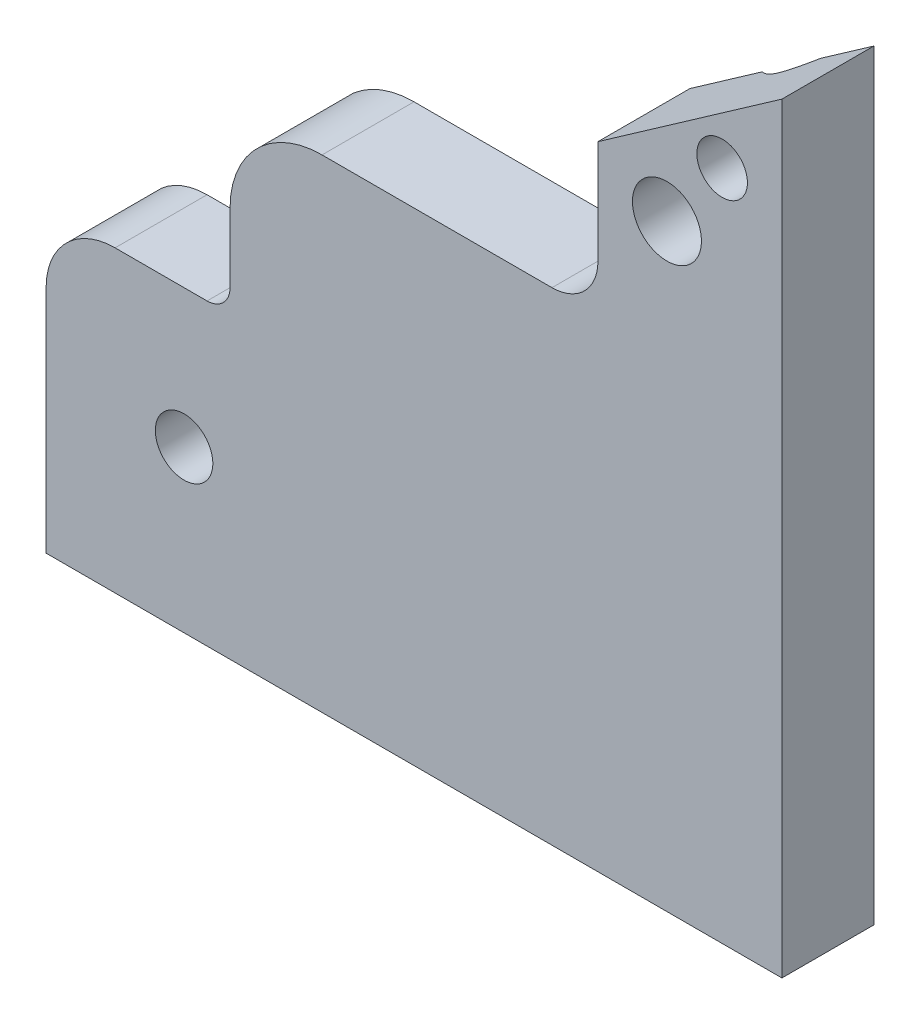
from build123d import *

# Parameters (mm, degrees)
SKETCH1_W                     = 32
SKETCH1_H                     = 27.5
BOSS_EXTRUDE1_DEPTH           = 4
SKETCH2_W                     = 8
SKETCH2_H                     = 14.5
CUT_EXTRUDE1_DEPTH            = 42.112650121
SKETCH3_W                     = 16
SKETCH3_H                     = 6.5
CUT_EXTRUDE2_DEPTH            = 42.112650121
DRAFT1_ANGLE                  = 35.000000002
F_3_0_3_DIAMETER_HOLE1_D      = 3
CSK_FOR_M3_SFHCS1_D           = 2.2
CSK_FOR_M3_SFHCS1_DEPTH       = 9.5
CSK_FOR_M3_SFHCS1_CSINK_D     = 4.6
CSK_FOR_M3_SFHCS1_CSINK_ANGLE = 90
CSK_FOR_M3_SFHCS1_TIP         = 0.660946681
M3X0_5_TAPPED_HOLE2_D         = 2.5
M3X0_5_TAPPED_HOLE2_DEPTH     = 7.5
M3X0_5_TAPPED_HOLE2_TIP       = 0.751075774
FILLET1_R                     = 1
FILLET2_R                     = 2
FILLET3_R                     = 3
FILLET4_R                     = 4
M3X0_5_TAPPED_HOLE1_D         = 2.5


with BuildPart() as part:
    # Sketch1 → Boss-Extrude1 (new body)
    with BuildSketch(Plane.XY.offset(4)):
        with Locations((16, 11.75)):
            Rectangle(SKETCH1_W, SKETCH1_H)
    extrude(amount=-BOSS_EXTRUDE1_DEPTH)

    # Sketch2 → Cut-Extrude1 (cut, through all)
    with BuildSketch(Plane(origin=(0, 0, 0), x_dir=(-1, 0, 0), z_dir=(0, 0, -1))):
        with Locations((-4, 18.25)):
            Rectangle(SKETCH2_W, SKETCH2_H)
    extrude(amount=-CUT_EXTRUDE1_DEPTH, mode=Mode.SUBTRACT)

    # Sketch3 → Cut-Extrude2 (cut, through all)
    with BuildSketch(Plane(origin=(0, 0, 0), x_dir=(-1, 0, 0), z_dir=(0, 0, -1))):
        with Locations((-16, 22.25)):
            Rectangle(SKETCH3_W, SKETCH3_H)
    extrude(amount=-CUT_EXTRUDE2_DEPTH, mode=Mode.SUBTRACT)

    # Draft1
    draft1_faces = [part.faces().sort_by_distance(p)[0] for p in [
        (28, 25.5, 2),
    ]]
    draft(draft1_faces, Plane(origin=(24, 25.5, 4), x_dir=(0, 0, -1), z_dir=(-1, 0, 0)), DRAFT1_ANGLE)

    # Ø3.0 (3) Diameter Hole1 (through all)
    with Locations(Plane(origin=(0, 0, 0), x_dir=(-1, 0, 0), z_dir=(0, 0, -1))):
        with Locations((-27, 24)):
            Hole(F_3_0_3_DIAMETER_HOLE1_D / 2)

    # CSK for M3 SFHCS1
    with Locations(Plane(origin=(0, 0, 0), x_dir=(-1, 0, 0), z_dir=(0, 0, -1))):
        with Locations((-29.4, 27.2)):
            CounterSinkHole(CSK_FOR_M3_SFHCS1_D / 2, CSK_FOR_M3_SFHCS1_CSINK_D / 2, depth=CSK_FOR_M3_SFHCS1_DEPTH, counter_sink_angle=CSK_FOR_M3_SFHCS1_CSINK_ANGLE)
            with Locations((0, 0, -(CSK_FOR_M3_SFHCS1_DEPTH + CSK_FOR_M3_SFHCS1_TIP / 2))):  # 118° drill point
                Cone(0, CSK_FOR_M3_SFHCS1_D / 2, CSK_FOR_M3_SFHCS1_TIP, mode=Mode.SUBTRACT)

    # M3x0.5 Tapped Hole2
    with Locations(Plane(origin=(0, -2, 0), x_dir=(-1, 0, 0), z_dir=(0, -1, 0))):
        with Locations((-10, -2), (-19.5, -2), (-29, -2)):
            Hole(M3X0_5_TAPPED_HOLE2_D / 2, depth=M3X0_5_TAPPED_HOLE2_DEPTH)
            with Locations((0, 0, -(M3X0_5_TAPPED_HOLE2_DEPTH + M3X0_5_TAPPED_HOLE2_TIP / 2))):  # 118° drill point
                Cone(0, M3X0_5_TAPPED_HOLE2_D / 2, M3X0_5_TAPPED_HOLE2_TIP, mode=Mode.SUBTRACT)

    # Fillet1
    fillet1_edges = [part.edges().sort_by_distance(p)[0] for p in [
        (8, 11, 2),
    ]]
    fillet(fillet1_edges, radius=FILLET1_R)

    # Fillet2
    fillet2_edges = [part.edges().sort_by_distance(p)[0] for p in [
        (24, 19, 2),
    ]]
    fillet(fillet2_edges, radius=FILLET2_R)

    # Fillet3
    fillet3_edges = [part.edges().sort_by_distance(p)[0] for p in [
        (0, 11, 2),
    ]]
    fillet(fillet3_edges, radius=FILLET3_R)

    # Fillet4
    fillet4_edges = [part.edges().sort_by_distance(p)[0] for p in [
        (8, 19, 2),
    ]]
    fillet(fillet4_edges, radius=FILLET4_R)

    # M3x0.5 Tapped Hole1 (through all)
    with Locations(Plane(origin=(6, 5, 0), x_dir=(-1, 0, 0), z_dir=(0, 0, -1))):
        with Locations((0, 0)):
            Hole(M3X0_5_TAPPED_HOLE1_D / 2)


solid = part.part
